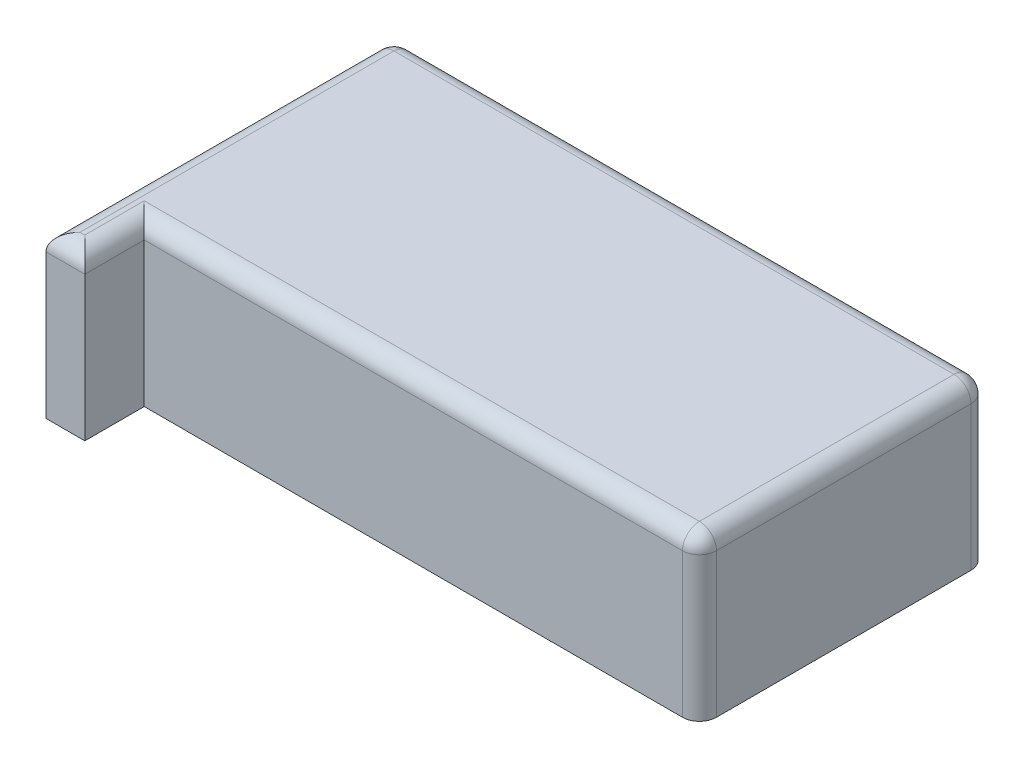
from build123d import *

# Parameters (mm, degrees)
SKETCH1_W           = 70
SKETCH1_H           = 34
BOSS_EXTRUDE1_DEPTH = 19
SKETCH2_W           = 4.574362022
SKETCH2_H           = 19
BOSS_EXTRUDE2_DEPTH = 7
FILLET2_R           = 2
FILLET3_R           = 2


with BuildPart() as part:
    # Sketch1 → Boss-Extrude1 (new body)
    with BuildSketch(Plane(origin=(0, 0, 0), x_dir=(1, 0, 0), z_dir=(0, 1, 0))):
        with Locations((35, 17)):
            Rectangle(SKETCH1_W, SKETCH1_H)
    extrude(amount=BOSS_EXTRUDE1_DEPTH)

    # Sketch2 → Boss-Extrude2 (add)
    with BuildSketch(Plane.XY):
        with Locations((2.287181011, 9.5)):
            Rectangle(SKETCH2_W, SKETCH2_H)
    extrude(amount=BOSS_EXTRUDE2_DEPTH)

    # Fillet2
    fillet2_edges = [part.edges().sort_by_distance(p)[0] for p in [
        (35, 19, -34),
        (37.287181011, 19, 0),
    ]]
    fillet(fillet2_edges, radius=FILLET2_R)

    # Fillet3
    fillet3_edges = [part.edges().sort_by_distance(p)[0] for p in [
        (0, 8.5, -34),
        (0, 18.414213562, -33.414213562),
        (70, 8.5, 0),
        (70, 18.414213562, -0.585786438),
        (70, 18.414213562, -33.414213562),
        (4.574362022, 19, 2.5),
        (2.287181011, 19, 7),
        (0, 19, -12.5),
        (70, 19, -17),
        (70, 8.5, -34),
    ]]
    fillet(fillet3_edges, radius=FILLET3_R)


solid = part.part
